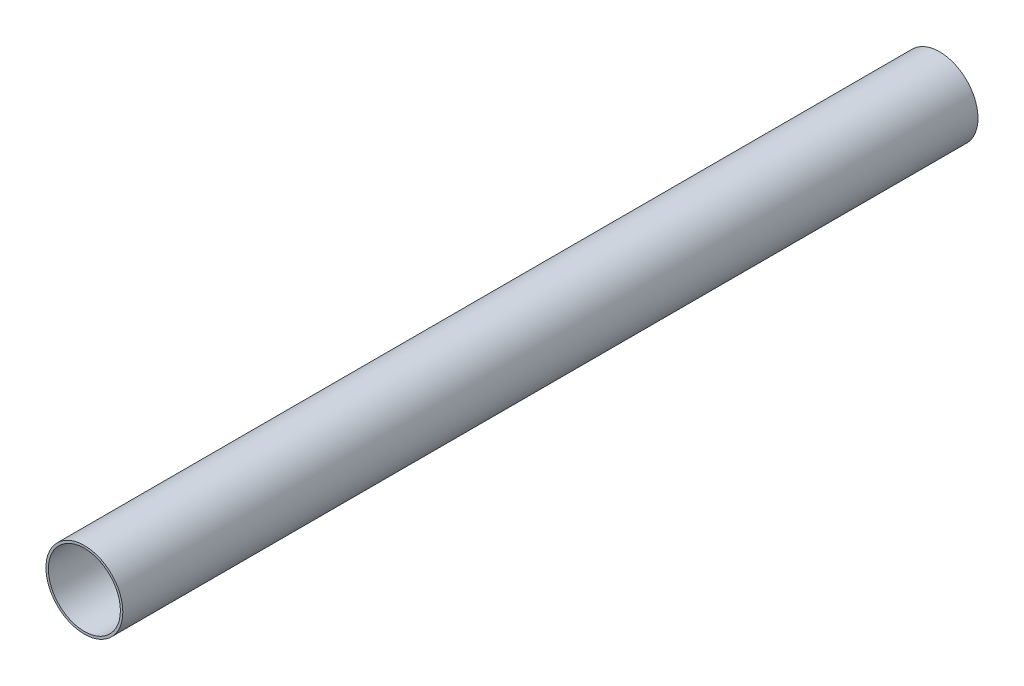
from build123d import *

# Parameters (mm, degrees)
SKETCH1_R           = 25.4
SKETCH1_R_2         = 23.8125
BOSS_EXTRUDE1_DEPTH = 282.606506287


with BuildPart() as part:
    # Sketch1 → Boss-Extrude1 (new, symmetric)
    with BuildSketch(Plane.XY):
        Circle(SKETCH1_R)
        Circle(SKETCH1_R_2, mode=Mode.SUBTRACT)
    extrude(amount=BOSS_EXTRUDE1_DEPTH, both=True)


solid = part.part
